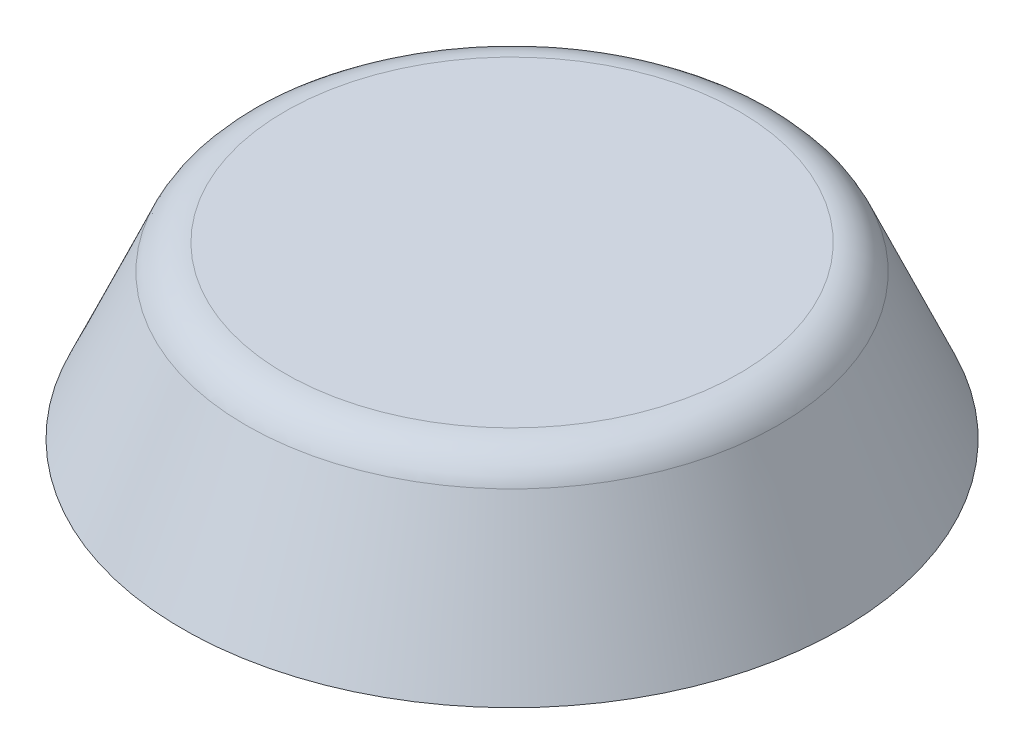
from build123d import *

# Parameters (mm, degrees)
FILLET1_R = 0.79375


with BuildPart() as part:
    # Sketch1 → Revolve1 (revolve)
    with BuildSketch(Plane.XY, mode=Mode.PRIVATE) as revolve1_sk:
        Polygon((0, 0), (-6.1595, 0), (-4.7625, 3.175), (0, 3.175), align=None)
    revolve(revolve1_sk.sketch.rotate(Axis((0, 0, 0), (0, 1, 0)), 270), axis=Axis((0, 0, 0), (0, 1, 0)))

    # Fillet1
    fillet1_edges = [part.edges().sort_by_distance(p)[0] for p in [
        (0, 3.175, 4.7625),
    ]]
    fillet(fillet1_edges, radius=FILLET1_R)


solid = part.part
